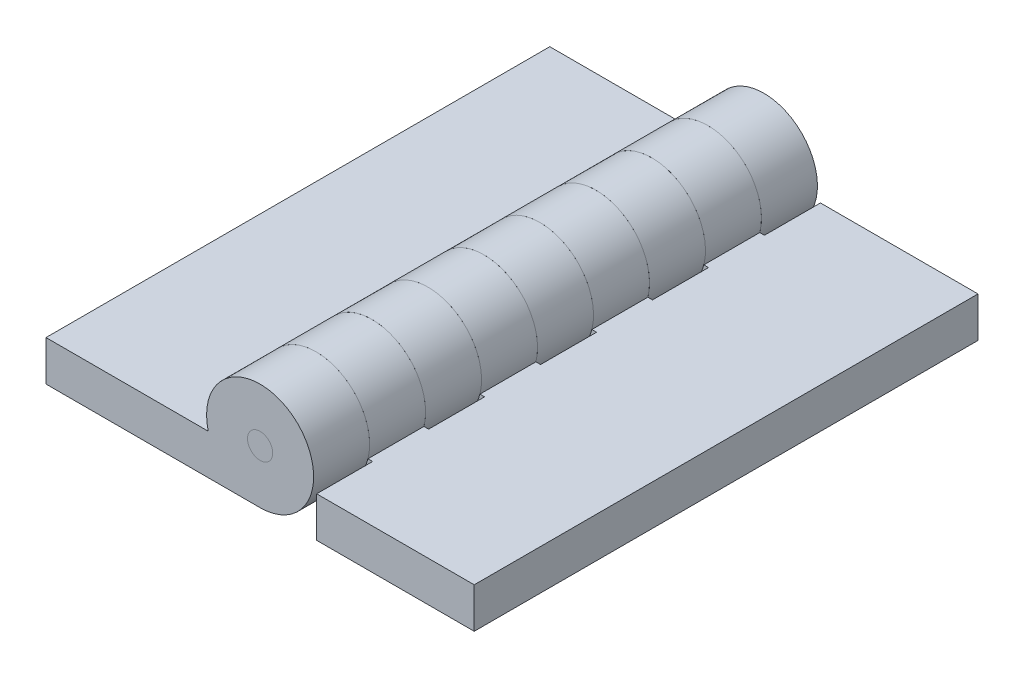
from build123d import *

# Parameters (mm, degrees)
SKETCH1_R               = 1.5875
EXTRUDE1_DEPTH          = 31.75
SKETCH1_W               = 19.859625
SKETCH1_H               = 5.08
EXTRUDE1_2_DEPTH        = 31.75
EXTRUDE24_DEPTH         = 45.185664218
EXTRUDE24_DEPTH_BACK    = 45.185664218
SKETCH20_W              = 14.25575
SKETCH20_H              = 7.055555556
SKETCH21_R              = 1.5875
EXTRUDE25_DEPTH         = 7.055555556
EXTRUDE26_START         = 14.11111
SKETCH21_2_R            = 1.5875
EXTRUDE26_DEPTH         = 7.055555556
EXTRUDE27_START         = 28.22222
SKETCH21_3_R            = 1.5875
EXTRUDE27_DEPTH         = 7.055555556
EXTRUDE28_START         = 42.33333
SKETCH21_4_R            = 1.5875
EXTRUDE28_DEPTH         = 7.055555556
EXTRUDE29_START         = 56.44444
SKETCH21_5_R            = 1.5875
EXTRUDE29_DEPTH         = 7.055555556
CUT_EXTRUDE2_DEPTH      = 45.185664218
CUT_EXTRUDE2_DEPTH_BACK = 45.185664218
SKETCH22_W              = 8.334375
SKETCH22_H              = 2.5796875


with BuildPart() as part:
    # Sketch1 → Extrude1 (new, symmetric)
    with BuildSketch(Plane.XY):
        with BuildLine():
            Line((26.9875, -6.746875), (0, -6.746875))
            ThreePointArc((0, -6.746875), (-4.139693527, 5.327594182), (6.53772514, -1.666875))
            Line((6.53772514, -1.666875), (26.9875, -1.666875))
            Line((26.9875, -1.666875), (26.9875, -6.746875))
        make_face()
        Circle(SKETCH1_R, mode=Mode.SUBTRACT)
    extrude(amount=EXTRUDE1_DEPTH, both=True)

    # Sketch20 → Extrude24 (cut, two sides: drawn at the far end of the back side and taken through both)
    with BuildSketch(Plane(origin=(0, 0, 0), x_dir=(1, 0, 0), z_dir=(0, 1, 0)).offset(-EXTRUDE24_DEPTH_BACK)):
        with Locations((0, 28.222222222)):
            Rectangle(SKETCH20_W, SKETCH20_H)
        with Locations((0, 14.111111111)):
            Rectangle(SKETCH20_W, SKETCH20_H)
        Rectangle(SKETCH20_W, SKETCH20_H)
        with Locations((0, -14.111111111)):
            Rectangle(SKETCH20_W, SKETCH20_H)
        with Locations((0, -28.222222222)):
            Rectangle(SKETCH20_W, SKETCH20_H)
    extrude(amount=EXTRUDE24_DEPTH + EXTRUDE24_DEPTH_BACK, mode=Mode.SUBTRACT)


with BuildPart() as body_2:
    # Sketch1 → Extrude1 2 (new, symmetric)
    with BuildSketch(Plane.XY):
        with Locations((-17.0576875, -4.206875)):
            Rectangle(SKETCH1_W, SKETCH1_H)
    extrude(amount=EXTRUDE1_2_DEPTH, both=True)

    # Sketch21 → Extrude25 (add)
    with BuildSketch(Plane.XY.offset(-31.75)):
        with BuildLine():
            Line((-7.127875, -1.666875), (-6.53772514, -1.666875))
            ThreePointArc((-6.53772514, -1.666875), (4.139693527, 5.327594182), (0, -6.746875))
            Line((0, -6.746875), (-7.127875, -6.746875))
            Line((-7.127875, -6.746875), (-7.127875, -1.666875))
        make_face()
        with Locations(Location((0, 0, 0), (0, 0, 180))):
            Circle(SKETCH21_R, mode=Mode.SUBTRACT)
    extrude(amount=EXTRUDE25_DEPTH)

    # Sketch21<2> → Extrude26 (add)
    with BuildSketch(Plane.XY.offset(-31.75).offset(EXTRUDE26_START)):
        with BuildLine():
            Line((-7.127875, -1.666875), (-6.53772514, -1.666875))
            ThreePointArc((-6.53772514, -1.666875), (4.139693527, 5.327594182), (0, -6.746875))
            Line((0, -6.746875), (-7.127875, -6.746875))
            Line((-7.127875, -6.746875), (-7.127875, -1.666875))
        make_face()
        with Locations(Location((0, 0, 0), (0, 0, 180))):
            Circle(SKETCH21_2_R, mode=Mode.SUBTRACT)
    extrude(amount=EXTRUDE26_DEPTH)

    # Sketch21<3> → Extrude27 (add)
    with BuildSketch(Plane.XY.offset(-31.75).offset(EXTRUDE27_START)):
        with BuildLine():
            Line((-7.127875, -1.666875), (-6.53772514, -1.666875))
            ThreePointArc((-6.53772514, -1.666875), (4.139693527, 5.327594182), (0, -6.746875))
            Line((0, -6.746875), (-7.127875, -6.746875))
            Line((-7.127875, -6.746875), (-7.127875, -1.666875))
        make_face()
        with Locations(Location((0, 0, 0), (0, 0, 180))):
            Circle(SKETCH21_3_R, mode=Mode.SUBTRACT)
    extrude(amount=EXTRUDE27_DEPTH)

    # Sketch21<4> → Extrude28 (add)
    with BuildSketch(Plane.XY.offset(-31.75).offset(EXTRUDE28_START)):
        with BuildLine():
            Line((-7.127875, -1.666875), (-6.53772514, -1.666875))
            ThreePointArc((-6.53772514, -1.666875), (4.139693527, 5.327594182), (0, -6.746875))
            Line((0, -6.746875), (-7.127875, -6.746875))
            Line((-7.127875, -6.746875), (-7.127875, -1.666875))
        make_face()
        with Locations(Location((0, 0, 0), (0, 0, 180))):
            Circle(SKETCH21_4_R, mode=Mode.SUBTRACT)
    extrude(amount=EXTRUDE28_DEPTH)

    # Sketch21<5> → Extrude29 (add)
    with BuildSketch(Plane.XY.offset(-31.75).offset(EXTRUDE29_START)):
        with BuildLine():
            Line((-7.127875, -1.666875), (-6.53772514, -1.666875))
            ThreePointArc((-6.53772514, -1.666875), (4.139693527, 5.327594182), (0, -6.746875))
            Line((0, -6.746875), (-7.127875, -6.746875))
            Line((-7.127875, -6.746875), (-7.127875, -1.666875))
        make_face()
        with Locations(Location((0, 0, 0), (0, 0, 180))):
            Circle(SKETCH21_5_R, mode=Mode.SUBTRACT)
    extrude(amount=EXTRUDE29_DEPTH)


with BuildPart() as body_3:
    # Sketch6 → Revolve1 (revolve)
    with BuildSketch(Plane(origin=(0, 0, 0), x_dir=(1, 0, 0), z_dir=(0, 1, 0))):
        with BuildLine():
            Line((-4.1671875, 31.75), (-1.5875, 31.75))
            Line((-1.5875, 31.75), (-1.5875, -31.75))
            Line((-1.5875, -31.75), (-4.1671875, -31.75))
            ThreePointArc((-4.1671875, -31.75), (-2.450522355, -33.632574574), (0, -34.3296875))
            Line((0, -34.3296875), (0, 34.3296875))
            ThreePointArc((0, 34.3296875), (-2.450522355, 33.632574574), (-4.1671875, 31.75))
        make_face()
    revolve(axis=Axis((0, 0, -34.3296875), (0, 0, 1)))

    # Sketch22 → Cut-Extrude2 (cut, two sides: drawn at the far end of the back side and taken through both)
    with BuildSketch(Plane(origin=(0, 0, 0), x_dir=(1, 0, 0), z_dir=(0, 1, 0)).offset(-CUT_EXTRUDE2_DEPTH_BACK)):
        with Locations((0, 33.03984375)):
            Rectangle(SKETCH22_W, SKETCH22_H)
        with Locations((0, -33.03984375)):
            Rectangle(SKETCH22_W, SKETCH22_H)
    extrude(amount=CUT_EXTRUDE2_DEPTH + CUT_EXTRUDE2_DEPTH_BACK, mode=Mode.SUBTRACT)


solid = Compound([part.part, body_2.part, body_3.part])
